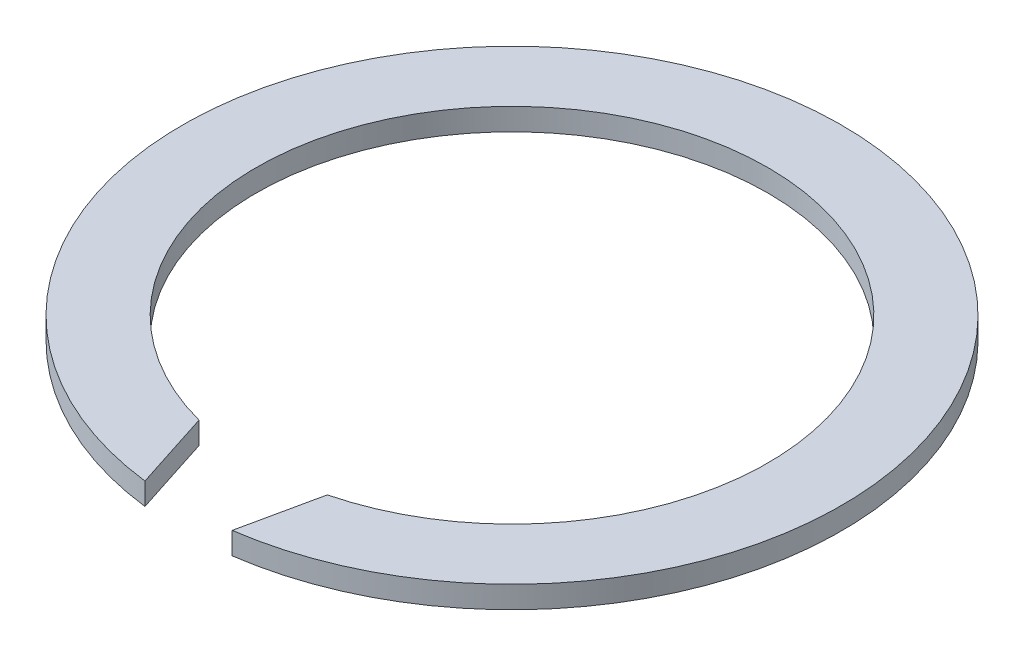
from build123d import *

# Parameters (mm, degrees)
EXTRUDE_1_DEPTH = 1.2


with BuildPart() as part:
    # Эскиз1 → Бобышка-Вытянуть1 (new body)
    with BuildSketch(Plane(origin=(0, 0, 0), x_dir=(1, 0, 0), z_dir=(0, 1, 0))):
        with BuildLine():
            Line((-3.309893458, -15.47653173), (-1.91354972, -19.810127919))
            ThreePointArc((-1.91354972, -19.810127919), (0.083241388, 15.856721352), (2.778703548, -19.764140448))
            Line((2.778703548, -19.764140448), (3.692709753, -15.511544563))
            ThreePointArc((3.692709753, -15.511544563), (0.328164657, 11.85740723), (-3.309893458, -15.47653173))
        make_face()
    extrude(amount=EXTRUDE_1_DEPTH)


solid = part.part
